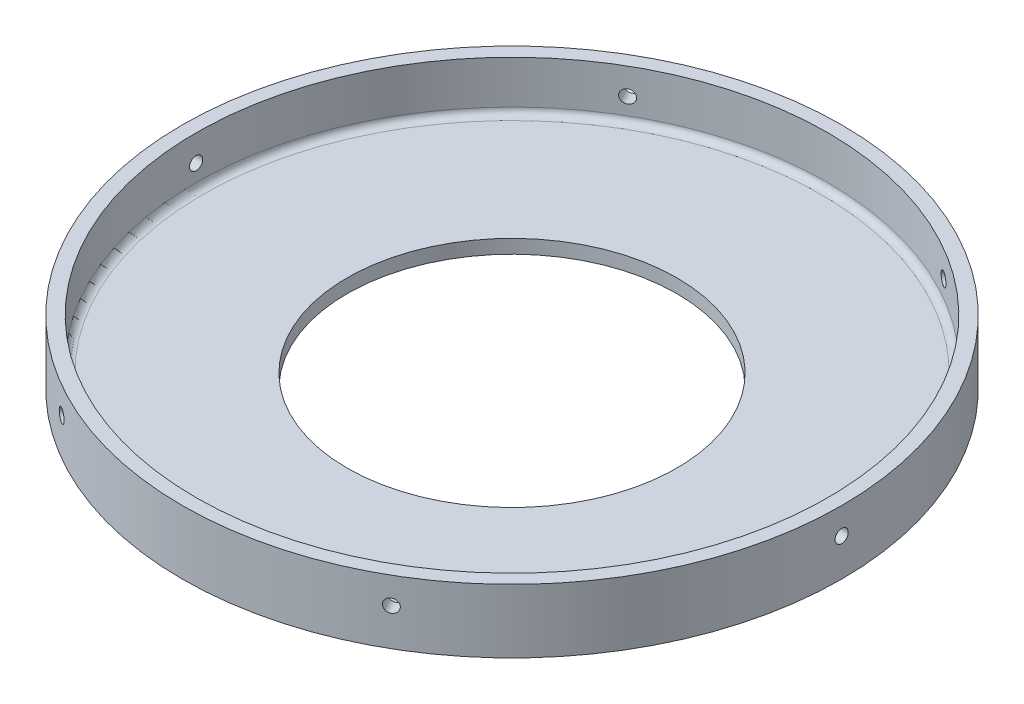
from build123d import *

# Parameters (mm, degrees)
SKETCH1_R           = 76.2
BOSS_EXTRUDE1_DEPTH = 16.256
SHELL1_T            = -3.175
FILLET1_R           = 1.5875
SKETCH2_R           = 38.1
CUT_EXTRUDE1_DEPTH  = 16.256
SKETCH3_R           = 1.524
CUT_EXTRUDE2_DEPTH  = 76.2
CIRPATTERN1_COUNT   = 6
CUT_EXTRUDE4_START  = -1.524
SKETCH5_R           = 76.2
CUT_EXTRUDE4_DEPTH  = 1.524


with BuildPart() as part:
    # Sketch1 → Boss-Extrude1 (new body)
    with BuildSketch(Plane(origin=(0, 0, 0), x_dir=(1, 0, 0), z_dir=(0, 1, 0))):
        with Locations(Location((0, 0, 0), (0, 0, 270))):
            Circle(SKETCH1_R)
    extrude(amount=BOSS_EXTRUDE1_DEPTH)

    # Shell1
    shell1_openings = [part.faces().sort_by_distance(p)[0] for p in [
        (0, 16.256, 0),
    ]]
    offset(amount=SHELL1_T, openings=shell1_openings, kind=Kind.INTERSECTION)

    # Fillet1
    fillet1_edges = [part.edges().sort_by_distance(p)[0] for p in [
        (0, 3.175, -73.025),
    ]]
    fillet(fillet1_edges, radius=FILLET1_R)

    # Sketch2 → Cut-Extrude1 (cut)
    with BuildSketch(Plane.XZ):
        with Locations(Location((0, 0, 0), (0, 0, 270))):
            Circle(SKETCH2_R)
    extrude(amount=-CUT_EXTRUDE1_DEPTH, mode=Mode.SUBTRACT)

    # Sketch3 → Cut-Extrude2 (cut)
    with BuildSketch(Plane(origin=(0, 0, 0), x_dir=(0, 0, -1), z_dir=(1, 0, 0))):
        with Locations((0, 8.636)):
            Circle(SKETCH3_R)
    cut_extrude2 = extrude(amount=-CUT_EXTRUDE2_DEPTH, mode=Mode.SUBTRACT)

    # CirPattern1: Cut-Extrude2 ×6 about axis
    cirpattern1_axis = Axis((0, 16.256, 0), (0, -1, 0))
    for i in range(1, CIRPATTERN1_COUNT):
        add(cut_extrude2.rotate(cirpattern1_axis, i * 360 / CIRPATTERN1_COUNT), mode=Mode.SUBTRACT)

    # Sketch5 → Cut-Extrude4 (cut)
    with BuildSketch(Plane(origin=(0, 16.256, 0), x_dir=(1, 0, 0), z_dir=(0, 1, 0)).offset(CUT_EXTRUDE4_START)):
        with Locations(Location((0, 0, 0), (0, 0, 270))):
            Circle(SKETCH5_R)
    extrude(amount=CUT_EXTRUDE4_DEPTH, mode=Mode.SUBTRACT)


solid = part.part
